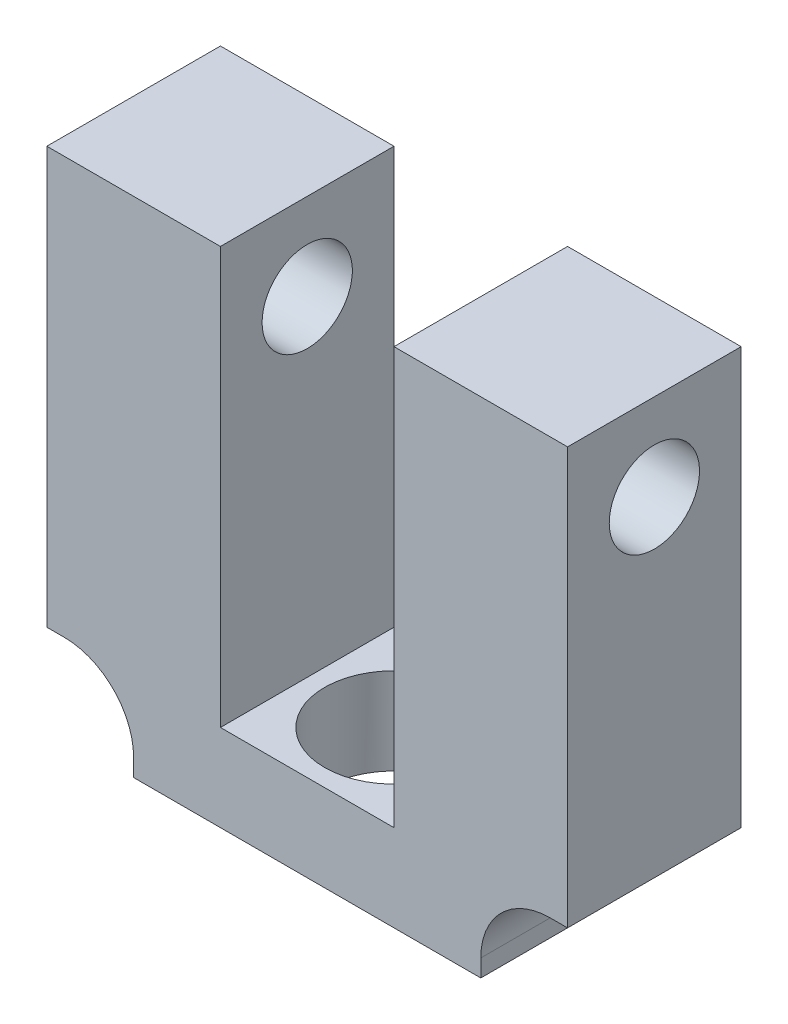
from build123d import *

# Parameters (mm, degrees)
SKETCH1_W           = 12.7
SKETCH1_H           = 6.35
BOSS_EXTRUDE1_DEPTH = 3.175
SKETCH2_W           = 6.35
SKETCH2_H           = 6.35
BOSS_EXTRUDE2_DEPTH = 15.24
FILLET1_R           = 2.54
SKETCH3_R           = 1.651
CUT_EXTRUDE1_DEPTH  = 22.606
SKETCH4_R           = 2.54
CUT_EXTRUDE2_DEPTH  = 22.606


with BuildPart() as part:
    # Sketch1 → Boss-Extrude1 (new body)
    with BuildSketch(Plane(origin=(0, 0, 0), x_dir=(1, 0, 0), z_dir=(0, 1, 0))):
        with Locations((6.35, 3.175)):
            Rectangle(SKETCH1_W, SKETCH1_H)
    extrude(amount=BOSS_EXTRUDE1_DEPTH)

    # Sketch2 → Boss-Extrude2 (add)
    with BuildSketch(Plane(origin=(0, 3.175, 0), x_dir=(1, 0, 0), z_dir=(0, 1, 0))):
        with Locations((0, 3.175)):
            Rectangle(SKETCH2_W, SKETCH2_H)
        with Locations((12.7, 3.175)):
            Rectangle(SKETCH2_W, SKETCH2_H)
    extrude(amount=BOSS_EXTRUDE2_DEPTH)

    # Fillet1
    fillet1_edges = [part.edges().sort_by_distance(p)[0] for p in [
        (12.7, 3.175, -3.175),
        (0, 3.175, -3.175),
    ]]
    fillet(fillet1_edges, radius=FILLET1_R)

    # Sketch3 → Cut-Extrude1 (cut)
    with BuildSketch(Plane.ZY.offset(3.175)):
        with Locations((-3.175, 15.24)):
            Circle(SKETCH3_R)
    extrude(amount=-CUT_EXTRUDE1_DEPTH, mode=Mode.SUBTRACT)

    # Sketch4 → Cut-Extrude2 (cut)
    with BuildSketch(Plane(origin=(0, 3.175, 0), x_dir=(1, 0, 0), z_dir=(0, 1, 0))):
        with Locations(Location((6.35, 3.175, 0), (0, 0, 270))):
            Circle(SKETCH4_R)
    extrude(amount=-CUT_EXTRUDE2_DEPTH, mode=Mode.SUBTRACT)


solid = part.part
